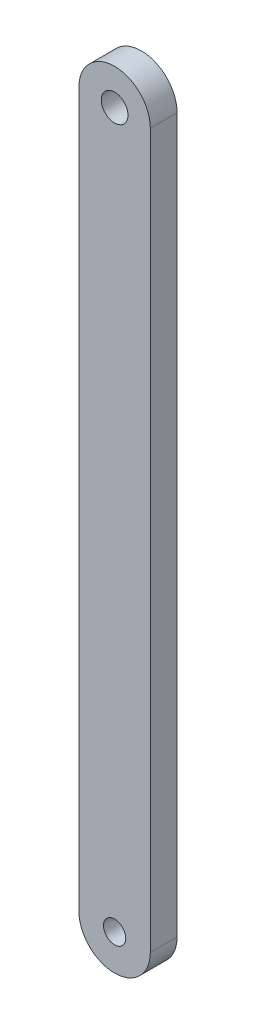
from build123d import *

# Parameters (mm, degrees)
SKETCH_1_R      = 1.25
SKETCH_1_R_2    = 1.5
EXTRUDE_1_DEPTH = 3


with BuildPart() as part:
    # 草圖1 → 填料-伸長1 (new body)
    with BuildSketch(Plane.XY):
        with BuildLine():
            Line((24.3003, 85.000200001), (24.3003, 5.00004388))
            ThreePointArc((24.3003, 5.00004388), (28.300189434, 1.00014388), (32.300099999, 5.000022748))
            Line((32.300099999, 5.000022748), (32.3001, 85.0001))
            ThreePointArc((32.3001, 85.0001), (28.300250001, 89.000100001), (24.3003, 85.000200001))
        make_face()
        with Locations((28.3002, 5.00004388)):
            Circle(SKETCH_1_R, mode=Mode.SUBTRACT)
        with Locations((28.300200001, 85.000200001)):
            Circle(SKETCH_1_R_2, mode=Mode.SUBTRACT)
    extrude(amount=EXTRUDE_1_DEPTH)


solid = part.part
